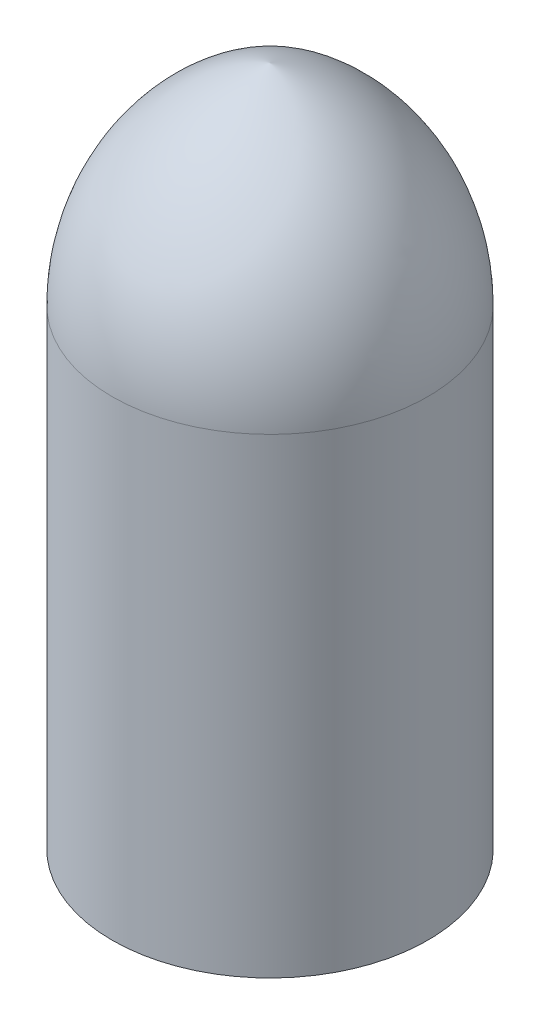
from build123d import *


with BuildPart() as part:
    # Sketch1 → Revolve3 (revolve)
    with BuildSketch(Plane.XY, mode=Mode.PRIVATE) as revolve3_sk:
        with BuildLine():
            Line((55, 0), (57, 0))
            Line((57, 0), (57, 170))
            ThreePointArc((57, 170), (41.161458118, 217.437664015), (0, 245.8441024))
            Line((0, 245.8441024), (0, 243.759689555))
            ThreePointArc((0, 243.759689555), (39.73634205, 216.004053635), (55, 170))
            Line((55, 170), (55, 0))
        make_face()
    revolve(revolve3_sk.sketch.rotate(Axis((0, 240.623917372, 0), (0, 1, 0)), 90), axis=Axis((0, 240.623917372, 0), (0, 1, 0)))


solid = part.part
